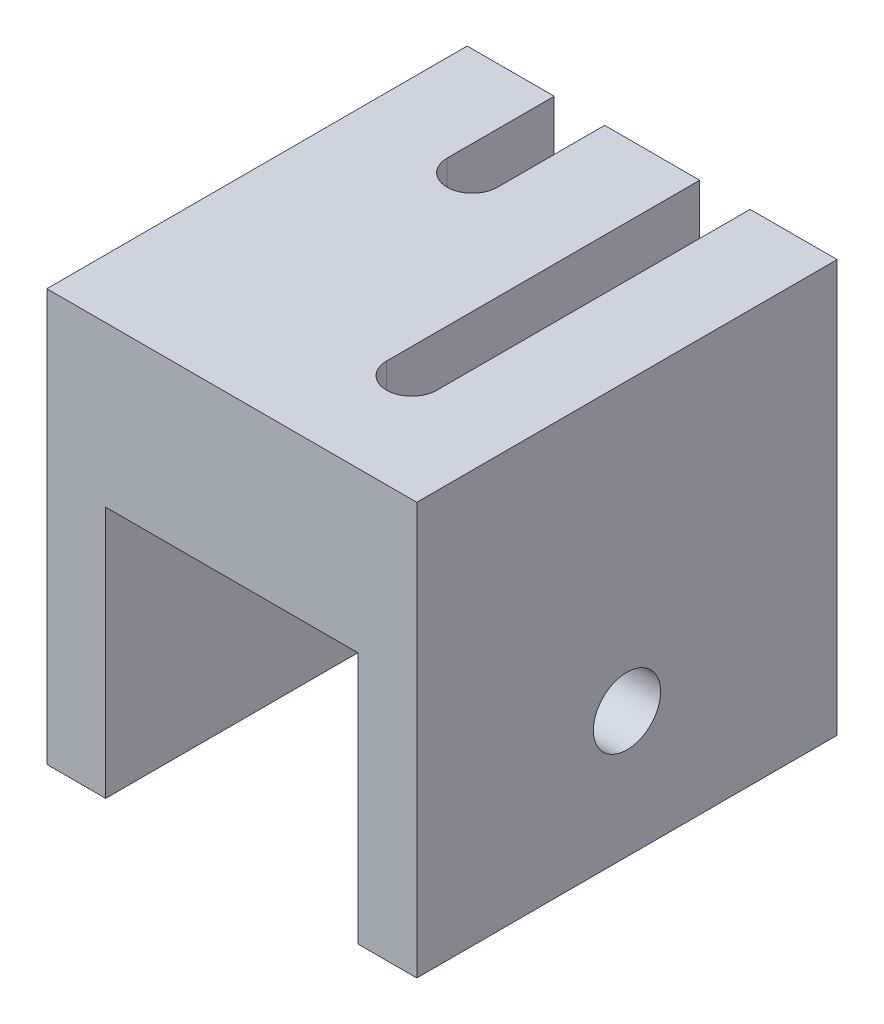
from build123d import *

# Parameters (mm, degrees)
BOSS_EXTRUDE1_DEPTH = 50
BOSS_EXTRUDE2_DEPTH = 6
BOSS_EXTRUDE4_DEPTH = 6
SKETCH5_R           = 4
CUT_EXTRUDE1_DEPTH  = 59


with BuildPart() as part:
    # Sketch1 → Boss-Extrude1 (new body)
    with BuildSketch(Plane.XY):
        Polygon((-22, 22), (-22, -15), (-15, -15), (-15, 15), (15, 15), (15, -15), (22, -15), (22, 22), align=None)
    extrude(amount=BOSS_EXTRUDE1_DEPTH)

    # Sketch3 → Boss-Extrude2 (add)
    with BuildSketch(Plane(origin=(0, 22, 0), x_dir=(1, 0, 0), z_dir=(0, 1, 0))):
        with BuildLine():
            ThreePointArc((-3.650247964, -12.745482051), (-8.650247964, -17.745482051), (-13.650247964, -12.745482051))
            Line((-13.650247964, -12.745482051), (-13.650247964, 0))
            Line((-13.650247964, 0), (-22, 0))
            Line((-22, 0), (-22, -50))
            Line((-22, -50), (22, -50))
            Line((22, -50), (22, 0))
            Line((22, 0), (13.650247964, 0))
            Line((13.650247964, 0), (13.650247964, -37.254517949))
            ThreePointArc((13.650247964, -37.254517949), (8.650247964, -42.254517949), (3.650247964, -37.254517949))
            Line((3.650247964, -37.254517949), (3.650247964, 0))
            Line((3.650247964, 0), (-3.650247964, 0))
            Line((-3.650247964, 0), (-3.650247964, -12.745482051))
        make_face()
    extrude(amount=BOSS_EXTRUDE2_DEPTH)

    # Sketch4 → Boss-Extrude4 (add)
    with BuildSketch(Plane(origin=(0, 28, 0), x_dir=(1, 0, 0), z_dir=(0, 1, 0))):
        with BuildLine():
            ThreePointArc((11.650247964, -37.254517949), (8.650247964, -40.254517949), (5.650247964, -37.254517949))
            Line((5.650247964, -37.254517949), (5.650247964, 0))
            Line((5.650247964, 0), (3.650247964, 0))
            Line((3.650247964, 0), (3.650247964, -37.254517949))
            ThreePointArc((3.650247964, -37.254517949), (8.650247964, -42.254517949), (13.650247964, -37.254517949))
            Line((13.650247964, -37.254517949), (13.650247964, 0))
            Line((13.650247964, 0), (11.650247964, 0))
            Line((11.650247964, 0), (11.650247964, -37.254517949))
        make_face()
        with BuildLine():
            Line((-3.650247964, -12.745482051), (-3.650247964, 0))
            Line((-3.650247964, 0), (-5.650247964, 0))
            Line((-5.650247964, 0), (-5.650247964, -12.745482051))
            ThreePointArc((-5.650247964, -12.745482051), (-8.650247964, -15.745482051), (-11.650247964, -12.745482051))
            Line((-11.650247964, -12.745482051), (-11.650247964, 0))
            Line((-11.650247964, 0), (-13.650247964, 0))
            Line((-13.650247964, 0), (-13.650247964, -12.745482051))
            ThreePointArc((-13.650247964, -12.745482051), (-8.650247964, -17.745482051), (-3.650247964, -12.745482051))
        make_face()
        with BuildLine():
            Line((13.650247964, 0), (13.650247964, -37.254517949))
            ThreePointArc((13.650247964, -37.254517949), (8.650247964, -42.254517949), (3.650247964, -37.254517949))
            Line((3.650247964, -37.254517949), (3.650247964, 0))
            Line((3.650247964, 0), (-3.650247964, 0))
            Line((-3.650247964, 0), (-3.650247964, -12.745482051))
            ThreePointArc((-3.650247964, -12.745482051), (-8.650247964, -17.745482051), (-13.650247964, -12.745482051))
            Line((-13.650247964, -12.745482051), (-13.650247964, 0))
            Line((-13.650247964, 0), (-22, 0))
            Line((-22, 0), (-22, -50))
            Line((-22, -50), (22, -50))
            Line((22, -50), (22, 0))
            Line((22, 0), (13.650247964, 0))
        make_face()
    extrude(amount=BOSS_EXTRUDE4_DEPTH)

    # Sketch5 → Cut-Extrude1 (cut)
    with BuildSketch(Plane.ZY.offset(22)):
        with Locations((25, 0)):
            Circle(SKETCH5_R)
    extrude(amount=-CUT_EXTRUDE1_DEPTH, mode=Mode.SUBTRACT)


solid = part.part
